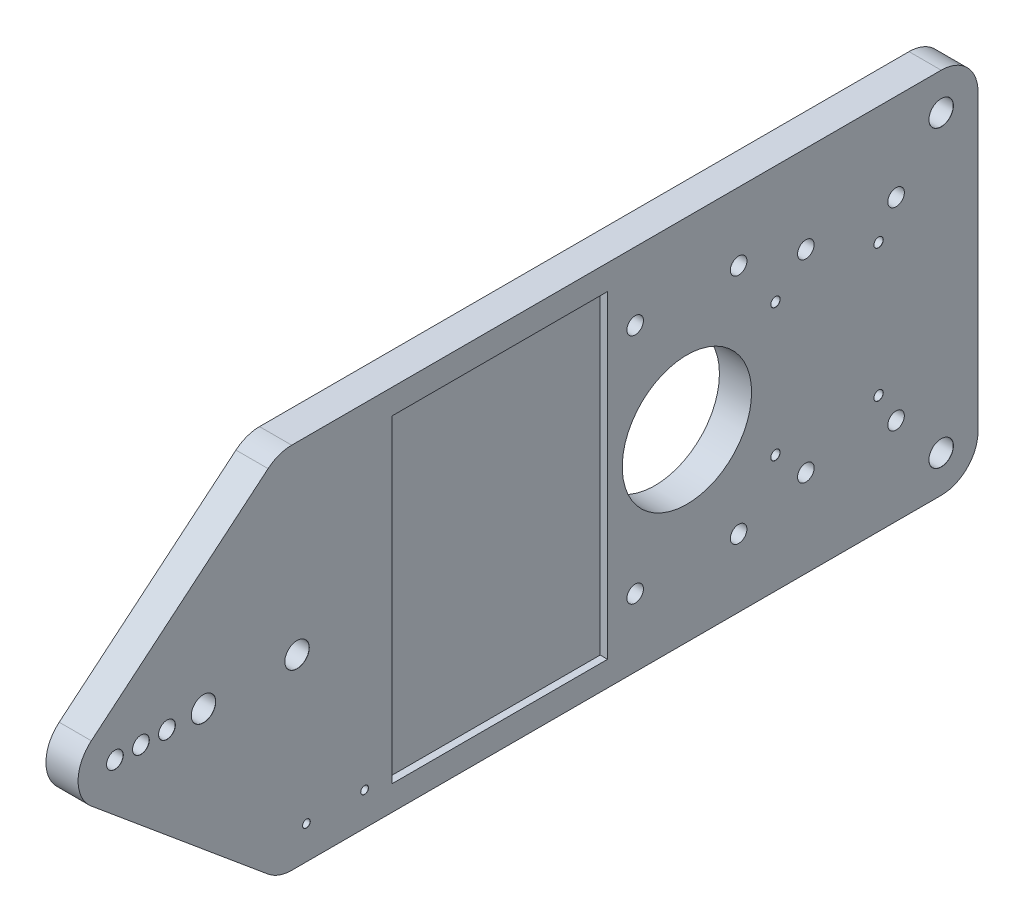
from build123d import *

# Parameters (mm, degrees)
SKETCH1_R                               = 2.25
SKETCH1_R_2                             = 17.5641
BOSS_EXTRUDE1_DEPTH                     = 4.365625
SKETCH2_W                               = 78.1
SKETCH2_H                               = 43.1
BOSS_EXTRUDE2_DEPTH                     = 8.73125
M4_CLEARANCE_HOLE2_AT_2_COUNT           = 2
M4_CLEARANCE_HOLE2_AT_2_PITCH           = 28.1
M4_CLEARANCE_HOLE2_AT_3_COUNT           = 2
M4_CLEARANCE_HOLE2_AT_3_PITCH           = 69.07401827
M4_CLEARANCE_HOLE2_AT_4_COUNT           = 2
M4_CLEARANCE_HOLE2_AT_4_PITCH           = 63.1
SKETCH24_W                              = 78.1
SKETCH24_H                              = 43.1
BOSS_EXTRUDE3_DEPTH                     = 8.73125
TAP_DRILL_FOR_M4X0_7_TAP1_AT_2_COUNT    = 2
TAP_DRILL_FOR_M4X0_7_TAP1_AT_2_PITCH    = 28.1
TAP_DRILL_FOR_M4X0_7_TAP1_AT_3_COUNT    = 2
TAP_DRILL_FOR_M4X0_7_TAP1_AT_3_PITCH    = 69.07401827
TAP_DRILL_FOR_M4X0_7_TAP1_AT_4_COUNT    = 2
TAP_DRILL_FOR_M4X0_7_TAP1_AT_4_PITCH    = 63.1
TAP_DRILL_FOR_M3X0_5_TAP1_AT_2_COUNT    = 2
TAP_DRILL_FOR_M3X0_5_TAP1_AT_2_PITCH    = 36
TAP_DRILL_FOR_M3X0_5_TAP1_AT_3_COUNT    = 2
TAP_DRILL_FOR_M3X0_5_TAP1_AT_3_PITCH    = 28
TAP_DRILL_FOR_M3X0_5_TAP1_AT_4_COUNT    = 2
TAP_DRILL_FOR_M3X0_5_TAP1_AT_4_PITCH    = 45.607017004
TAP_DRILL_FOR_M2_5X0_45_TAP2_AT_2_COUNT = 2
TAP_DRILL_FOR_M2_5X0_45_TAP2_AT_2_PITCH = 15.8
SKETCH3_R                               = 17.5641
CUT_EXTRUDE3_DEPTH                      = 181.027817403
M6_CLEARANCE_HOLE2_AT_2_COUNT           = 2
M6_CLEARANCE_HOLE2_AT_2_PITCH           = 80
SKETCH14_W                              = 86.5
SKETCH14_H                              = 58.5
CUT_EXTRUDE4_DEPTH                      = 2
FILLET4_R                               = 10
M4_CLEARANCE_HOLE1_AT_2_COUNT           = 2
M4_CLEARANCE_HOLE1_AT_2_PITCH           = 14.136551913
M4_CLEARANCE_HOLE1_AT_3_COUNT           = 2
M4_CLEARANCE_HOLE1_AT_3_PITCH           = 7.068275957
M6_CLEARANCE_HOLE1_AT_2_COUNT           = 2
M6_CLEARANCE_HOLE1_AT_2_PITCH           = 25.4
FILLET5_R                               = 5
FILLET6_R                               = 5
SKETCH28_W                              = 15.5
SKETCH28_H                              = 20.75
SKETCH28_R                              = 1.5
BOSS_EXTRUDE4_DEPTH                     = 2.5
FILLET7_R                               = 1
SKETCH29_R                              = 1.5
BOSS_EXTRUDE5_DEPTH                     = 1.5
FILLET8_R                               = 0.5


with BuildPart() as part:
    # Sketch1 → Boss-Extrude1 (new, symmetric)
    with BuildSketch(Plane.YZ):
        Polygon((0, 170.95), (-50, 110.95), (-50, -79.05), (50, -79.05), (50, 110.95), align=None)
        with Locations((-26.25, -56.8)):
            Circle(SKETCH1_R, mode=Mode.SUBTRACT)
        with Locations((-26.25, -32.3)):
            Circle(SKETCH1_R, mode=Mode.SUBTRACT)
        with Locations((26.25, -56.8)):
            Circle(SKETCH1_R, mode=Mode.SUBTRACT)
        with Locations((26.25, -32.3)):
            Circle(SKETCH1_R, mode=Mode.SUBTRACT)
        Circle(SKETCH1_R_2, mode=Mode.SUBTRACT)
    extrude(amount=BOSS_EXTRUDE1_DEPTH, both=True)


with BuildPart() as body_2:
    # Sketch2 → Boss-Extrude2 (new body)
    with BuildSketch(Plane.YZ.offset(4.365625)):
        Rectangle(SKETCH2_W, SKETCH2_H)
    extrude(amount=BOSS_EXTRUDE2_DEPTH)


with BuildPart() as m4_clearance_hole2_tool:
    # Sketch23 → M4 Clearance Hole2 (revolve)
    with BuildSketch(Plane(origin=(13.096875, -31.55, 14.05), x_dir=(0, 0, -1), z_dir=(0, 1, 0))):
        Polygon((0, 0), (0, 17.4625), (2.25, 17.4625), (2.25, 0.025), (2.275, 0), align=None)
    m4_clearance_hole2 = revolve(axis=Axis((19.446875, -31.55, 14.05), (-1, 0, 0)))


with BuildPart() as part_1:
    add(part.part)

    # M4 Clearance Hole2: cut by m4_clearance_hole2_tool
    add(m4_clearance_hole2_tool.part, mode=Mode.SUBTRACT)


with BuildPart() as body_2_1:
    add(body_2.part)

    # M4 Clearance Hole2: cut by m4_clearance_hole2_tool
    add(m4_clearance_hole2_tool.part, mode=Mode.SUBTRACT)


with BuildPart() as m4_clearance_hole2_at_2_tool:
    # M4 Clearance Hole2 at 2: M4 Clearance Hole2 ×2
    with Locations(*[(0, 0, -i * M4_CLEARANCE_HOLE2_AT_2_PITCH) for i in range(1, M4_CLEARANCE_HOLE2_AT_2_COUNT)]):
        add(m4_clearance_hole2)


with BuildPart() as part_2:
    add(part_1.part)

    # M4 Clearance Hole2 at 2: cut by m4_clearance_hole2_at_2_tool
    add(m4_clearance_hole2_at_2_tool.part, mode=Mode.SUBTRACT)


with BuildPart() as body_2_2:
    add(body_2_1.part)

    # M4 Clearance Hole2 at 2: cut by m4_clearance_hole2_at_2_tool
    add(m4_clearance_hole2_at_2_tool.part, mode=Mode.SUBTRACT)


with BuildPart() as m4_clearance_hole2_at_3_tool:
    # M4 Clearance Hole2 at 3: M4 Clearance Hole2 ×2
    with Locations(*[Vector(0, 0.9135128023552276, -0.40680998012966574) * (i * M4_CLEARANCE_HOLE2_AT_3_PITCH) for i in range(1, M4_CLEARANCE_HOLE2_AT_3_COUNT)]):
        add(m4_clearance_hole2)


with BuildPart() as part_3:
    add(part_2.part)

    # M4 Clearance Hole2 at 3: cut by m4_clearance_hole2_at_3_tool
    add(m4_clearance_hole2_at_3_tool.part, mode=Mode.SUBTRACT)


with BuildPart() as body_2_3:
    add(body_2_2.part)

    # M4 Clearance Hole2 at 3: cut by m4_clearance_hole2_at_3_tool
    add(m4_clearance_hole2_at_3_tool.part, mode=Mode.SUBTRACT)


with BuildPart() as m4_clearance_hole2_at_4_tool:
    # M4 Clearance Hole2 at 4: M4 Clearance Hole2 ×2
    with Locations(*[(0, i * M4_CLEARANCE_HOLE2_AT_4_PITCH, 0) for i in range(1, M4_CLEARANCE_HOLE2_AT_4_COUNT)]):
        add(m4_clearance_hole2)


with BuildPart() as part_4:
    add(part_3.part)

    # M4 Clearance Hole2 at 4: cut by m4_clearance_hole2_at_4_tool
    add(m4_clearance_hole2_at_4_tool.part, mode=Mode.SUBTRACT)

    # Sketch7 → Tap Drill for M3x0.5 Tap1 (revolve, cut)
    with BuildSketch(Plane(origin=(4.365625, -18, -24.05), x_dir=(0, 0, -1), z_dir=(0, 1, 0))):
        Polygon((0, 0), (0, 17.4625), (1.25, 17.4625), (1.25, 0.025), (1.275, 0), align=None)
    tap_drill_for_m3x0_5_tap1 = revolve(axis=Axis((10.715625, -18, -24.05), (-1, 0, 0)), mode=Mode.SUBTRACT)

    # Tap Drill for M3x0.5 Tap1 at 2: Tap Drill for M3x0.5 Tap1 ×2
    with Locations(*[(0, i * TAP_DRILL_FOR_M3X0_5_TAP1_AT_2_PITCH, 0) for i in range(1, TAP_DRILL_FOR_M3X0_5_TAP1_AT_2_COUNT)]):
        add(tap_drill_for_m3x0_5_tap1, mode=Mode.SUBTRACT)

    # Tap Drill for M3x0.5 Tap1 at 3: Tap Drill for M3x0.5 Tap1 ×2
    with Locations(*[(0, 0, -i * TAP_DRILL_FOR_M3X0_5_TAP1_AT_3_PITCH) for i in range(1, TAP_DRILL_FOR_M3X0_5_TAP1_AT_3_COUNT)]):
        add(tap_drill_for_m3x0_5_tap1, mode=Mode.SUBTRACT)

    # Tap Drill for M3x0.5 Tap1 at 4: Tap Drill for M3x0.5 Tap1 ×2
    with Locations(*[Vector(0, 0.7893522173763264, -0.6139406135149205) * (i * TAP_DRILL_FOR_M3X0_5_TAP1_AT_4_PITCH) for i in range(1, TAP_DRILL_FOR_M3X0_5_TAP1_AT_4_COUNT)]):
        add(tap_drill_for_m3x0_5_tap1, mode=Mode.SUBTRACT)

    # Sketch10 → Tap Drill for M2.5x0.45 Tap2 (revolve, cut)
    with BuildSketch(Plane(origin=(4.365625, -41, 103.325), x_dir=(0, 0, -1), z_dir=(0, 1, 0))):
        Polygon((0, 0), (0, 17.4625), (1.025, 17.4625), (1.025, 0.025), (1.05, 0), align=None)
    tap_drill_for_m2_5x0_45_tap2 = revolve(axis=Axis((10.715625, -41, 103.325), (-1, 0, 0)), mode=Mode.SUBTRACT)

    # Tap Drill for M2.5x0.45 Tap2 at 2: Tap Drill for M2.5x0.45 Tap2 ×2
    with Locations(*[(0, 0, -i * TAP_DRILL_FOR_M2_5X0_45_TAP2_AT_2_PITCH) for i in range(1, TAP_DRILL_FOR_M2_5X0_45_TAP2_AT_2_COUNT)]):
        add(tap_drill_for_m2_5x0_45_tap2, mode=Mode.SUBTRACT)

    # Sketch12 → M6 Clearance Hole2 (revolve, cut)
    with BuildSketch(Plane(origin=(4.365625, -40, -69.05), x_dir=(0, 0, -1), z_dir=(0, 1, 0))):
        Polygon((0, 0), (0, 17.4625), (3.3, 17.4625), (3.3, 0.025), (3.325, 0), align=None)
    m6_clearance_hole2 = revolve(axis=Axis((10.715625, -40, -69.05), (-1, 0, 0)), mode=Mode.SUBTRACT)

    # M6 Clearance Hole2 at 2: M6 Clearance Hole2 ×2
    with Locations(*[(0, i * M6_CLEARANCE_HOLE2_AT_2_PITCH, 0) for i in range(1, M6_CLEARANCE_HOLE2_AT_2_COUNT)]):
        add(m6_clearance_hole2, mode=Mode.SUBTRACT)

    # Sketch14 → Cut-Extrude4 (cut)
    with BuildSketch(Plane.YZ.offset(4.365625)):
        with Locations((0, 50.8)):
            Rectangle(SKETCH14_W, SKETCH14_H)
    extrude(amount=-CUT_EXTRUDE4_DEPTH, mode=Mode.SUBTRACT)

    # Fillet4
    fillet4_edges = [part_4.edges().sort_by_distance(p)[0] for p in [
        (0, 50, -79.05),
        (0, -50, -79.05),
        (0, 50, 110.95),
        (0, 0, 170.95),
        (0, -50, 110.95),
    ]]
    fillet(fillet4_edges, radius=FILLET4_R)

    # Sketch16 → M4 Clearance Hole1 (revolve, cut)
    with BuildSketch(Plane(origin=(4.365625, 0, 155.329500648), x_dir=(0, 0, -1), z_dir=(0, 1, 0))):
        Polygon((0, 0), (0, 17.4625), (2.25, 17.4625), (2.25, 0.025), (2.275, 0), align=None)
    m4_clearance_hole1 = revolve(axis=Axis((10.715625, 0, 155.329500648), (-1, 0, 0)), mode=Mode.SUBTRACT)

    # M4 Clearance Hole1 at 2: M4 Clearance Hole1 ×2
    with Locations(*[(0, 0, -i * M4_CLEARANCE_HOLE1_AT_2_PITCH) for i in range(1, M4_CLEARANCE_HOLE1_AT_2_COUNT)]):
        add(m4_clearance_hole1, mode=Mode.SUBTRACT)

    # M4 Clearance Hole1 at 3: M4 Clearance Hole1 ×2
    with Locations(*[(0, 0, -i * M4_CLEARANCE_HOLE1_AT_3_PITCH) for i in range(1, M4_CLEARANCE_HOLE1_AT_3_COUNT)]):
        add(m4_clearance_hole1, mode=Mode.SUBTRACT)

    # Sketch21 → M6 Clearance Hole1 (revolve, cut)
    with BuildSketch(Plane(origin=(4.365625, 0, 131.273931646), x_dir=(0, 0, -1), z_dir=(0, 1, 0))):
        Polygon((0, 0), (0, 17.4625), (3.3, 17.4625), (3.3, 0.025), (3.325, 0), align=None)
    m6_clearance_hole1 = revolve(axis=Axis((10.715625, 0, 131.273931646), (-1, 0, 0)), mode=Mode.SUBTRACT)

    # M6 Clearance Hole1 at 2: M6 Clearance Hole1 ×2
    with Locations(*[(0, 0, -i * M6_CLEARANCE_HOLE1_AT_2_PITCH) for i in range(1, M6_CLEARANCE_HOLE1_AT_2_COUNT)]):
        add(m6_clearance_hole1, mode=Mode.SUBTRACT)


with BuildPart() as body_2_4:
    add(body_2_3.part)

    # M4 Clearance Hole2 at 4: cut by m4_clearance_hole2_at_4_tool
    add(m4_clearance_hole2_at_4_tool.part, mode=Mode.SUBTRACT)


with BuildPart() as body_3:
    # Sketch24 → Boss-Extrude3 (new body)
    with BuildSketch(Plane(origin=(-4.365625, 0, 0), x_dir=(0, -1, 0), z_dir=(-1, 0, 0))):
        Rectangle(SKETCH24_W, SKETCH24_H)
    extrude(amount=BOSS_EXTRUDE3_DEPTH)

    # Sketch27 → Tap Drill for M4x0.7 Tap1 (revolve, cut)
    with BuildSketch(Plane(origin=(-13.096875, 31.55, 14.05), x_dir=(0, 0, 1), z_dir=(0, 1, 0))):
        Polygon((0, 0), (0, 9.722670021), (1.65, 8.73125), (1.65, 0.025), (1.675, 0), align=None)
    tap_drill_for_m4x0_7_tap1 = revolve(axis=Axis((-19.446875, 31.55, 14.05), (1, 0, 0)), mode=Mode.SUBTRACT)

    # Tap Drill for M4x0.7 Tap1 at 2: Tap Drill for M4x0.7 Tap1 ×2
    with Locations(*[(0, 0, -i * TAP_DRILL_FOR_M4X0_7_TAP1_AT_2_PITCH) for i in range(1, TAP_DRILL_FOR_M4X0_7_TAP1_AT_2_COUNT)]):
        add(tap_drill_for_m4x0_7_tap1, mode=Mode.SUBTRACT)

    # Tap Drill for M4x0.7 Tap1 at 3: Tap Drill for M4x0.7 Tap1 ×2
    with Locations(*[Vector(0, -0.9135128023552276, -0.40680998012966574) * (i * TAP_DRILL_FOR_M4X0_7_TAP1_AT_3_PITCH) for i in range(1, TAP_DRILL_FOR_M4X0_7_TAP1_AT_3_COUNT)]):
        add(tap_drill_for_m4x0_7_tap1, mode=Mode.SUBTRACT)

    # Tap Drill for M4x0.7 Tap1 at 4: Tap Drill for M4x0.7 Tap1 ×2
    with Locations(*[(0, -i * TAP_DRILL_FOR_M4X0_7_TAP1_AT_4_PITCH, 0) for i in range(1, TAP_DRILL_FOR_M4X0_7_TAP1_AT_4_COUNT)]):
        add(tap_drill_for_m4x0_7_tap1, mode=Mode.SUBTRACT)


with BuildPart() as cut_extrude3_tool:
    # Sketch3 → Cut-Extrude3 (new, through all)
    with BuildSketch(Plane.YZ.offset(13.096875)):
        Circle(SKETCH3_R)
    extrude(amount=-CUT_EXTRUDE3_DEPTH)


with BuildPart() as body_2_5:
    add(body_2_4.part)

    # Cut-Extrude3: cut by cut_extrude3_tool
    add(cut_extrude3_tool.part, mode=Mode.SUBTRACT)

    # Fillet6
    fillet6_edges = [body_2_5.edges().sort_by_distance(p)[0] for p in [
        (8.73125, -39.05, 21.55),
        (8.73125, 39.05, -21.55),
        (8.73125, -39.05, -21.55),
        (8.73125, 39.05, 21.55),
    ]]
    fillet(fillet6_edges, radius=FILLET6_R)


with BuildPart() as body_3_1:
    add(body_3.part)

    # Cut-Extrude3: cut by cut_extrude3_tool
    add(cut_extrude3_tool.part, mode=Mode.SUBTRACT)

    # Fillet5
    fillet5_edges = [body_3_1.edges().sort_by_distance(p)[0] for p in [
        (-8.73125, -39.05, 21.55),
        (-8.73125, -39.05, -21.55),
        (-8.73125, 39.05, -21.55),
        (-8.73125, 39.05, 21.55),
    ]]
    fillet(fillet5_edges, radius=FILLET5_R)


with BuildPart() as body_4:
    # Sketch28 → Boss-Extrude4 (new body)
    with BuildSketch(Plane.YZ.offset(4.365625)):
        with Locations((-46.275, 95.425)):
            Rectangle(SKETCH28_W, SKETCH28_H)
        with Locations((-41, 87.525)):
            Circle(SKETCH28_R, mode=Mode.SUBTRACT)
        with Locations((-41, 103.325)):
            Circle(SKETCH28_R, mode=Mode.SUBTRACT)
    extrude(amount=BOSS_EXTRUDE4_DEPTH)

    # Fillet7
    fillet7_edges = [body_4.edges().sort_by_distance(p)[0] for p in [
        (5.615625, -38.525, 105.8),
        (5.615625, -38.525, 85.05),
        (5.615625, -54.025, 85.05),
        (5.615625, -54.025, 105.8),
    ]]
    fillet(fillet7_edges, radius=FILLET7_R)

    # Sketch29 → Boss-Extrude5 (add)
    with BuildSketch(Plane(origin=(4.365625, 0, 0), x_dir=(0, -1, 0), z_dir=(-1, 0, 0))):
        with Locations((52.025, 104.175)):
            Circle(SKETCH29_R)
        with Locations((52.025, 100.675)):
            Circle(SKETCH29_R)
        with Locations((52.025, 97.175)):
            Circle(SKETCH29_R)
        with Locations((52.025, 93.675)):
            Circle(SKETCH29_R)
        with Locations((52.025, 90.175)):
            Circle(SKETCH29_R)
        with Locations((52.025, 86.675)):
            Circle(SKETCH29_R)
    extrude(amount=BOSS_EXTRUDE5_DEPTH)

    # Fillet8
    fillet8_edges = [body_4.edges().sort_by_distance(p)[0] for p in [
        (2.865625, -50.525, 86.675),
        (2.865625, -50.525, 90.175),
        (2.865625, -50.525, 93.675),
        (2.865625, -50.525, 97.175),
        (2.865625, -50.525, 100.675),
        (2.865625, -50.525, 104.175),
    ]]
    fillet(fillet8_edges, radius=FILLET8_R)


solid = part_4.part
